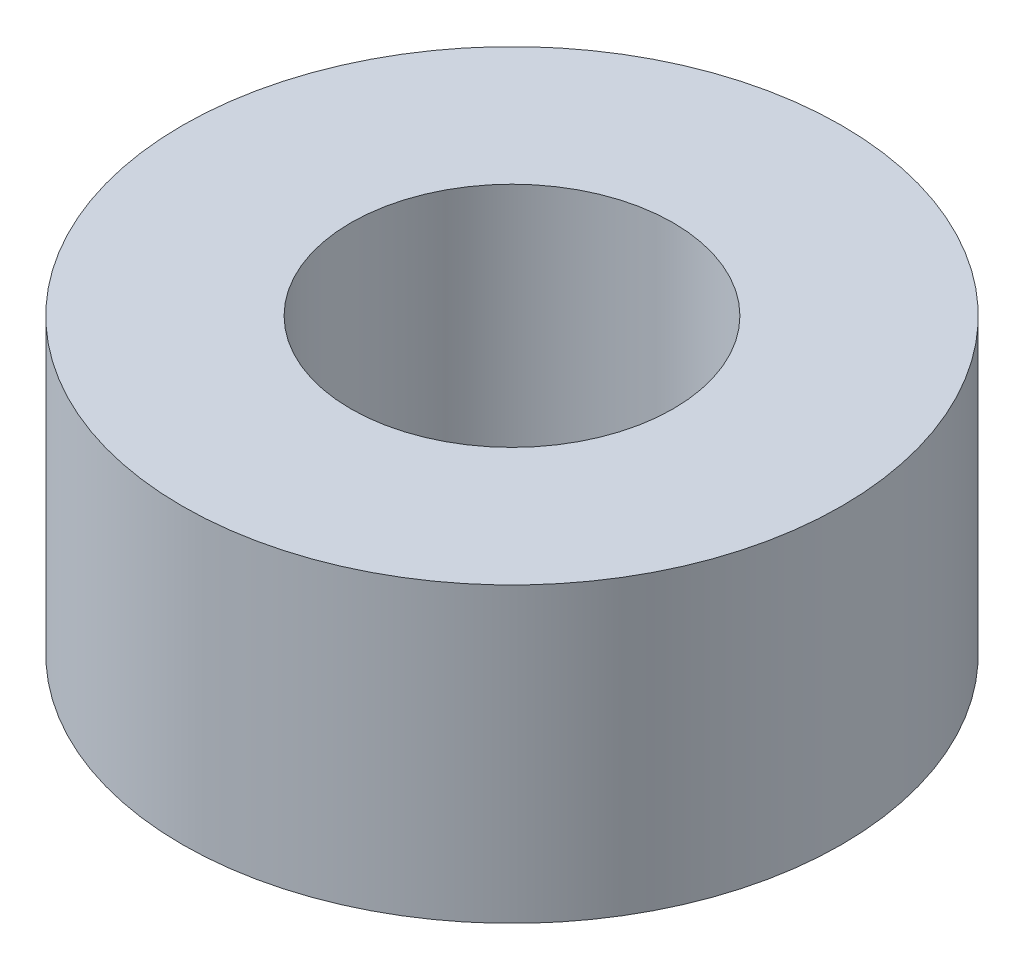
from build123d import *

# Parameters (mm, degrees)
SKIZZE1_R                       = 2.25
SKIZZE1_R_2                     = 1.1
AUFSATZ_LINEAR_AUSTRAGEN1_DEPTH = 2


with BuildPart() as part:
    # Skizze1 → Aufsatz-Linear austragen1 (new body)
    with BuildSketch(Plane(origin=(0, 0, 0), x_dir=(1, 0, 0), z_dir=(0, 1, 0))):
        Circle(SKIZZE1_R)
        Circle(SKIZZE1_R_2, mode=Mode.SUBTRACT)
    extrude(amount=AUFSATZ_LINEAR_AUSTRAGEN1_DEPTH)


solid = part.part
